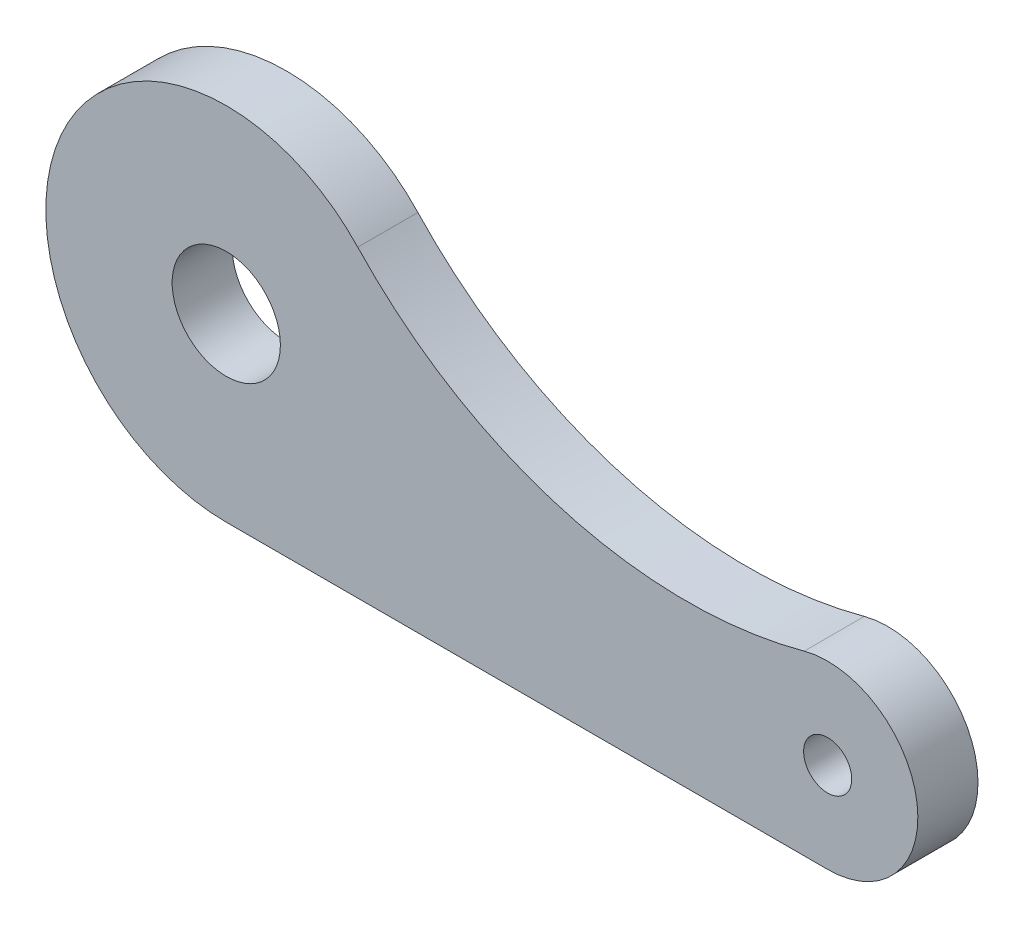
from build123d import *

# Parameters (mm, degrees)
SCHIZZO1_R                   = 4.5
SCHIZZO1_R_2                 = 2
ESTRUSIONE_ESTRUSIONE1_DEPTH = 5


with BuildPart() as part:
    # Schizzo1 → Estrusione-Estrusione1 (new body)
    with BuildSketch(Plane.XY):
        with BuildLine():
            Line((0, -15), (50, -15))
            ThreePointArc((50, -15), (57.434856863, -6.513641332), (48.044417196, -0.259440913))
            ThreePointArc((48.044417196, -0.259440913), (28.031173765, -0.132787617), (10.933286622, 10.269529864))
            ThreePointArc((10.933286622, 10.269529864), (-13.766679846, 5.956385315), (0, -15))
        make_face()
        Circle(SCHIZZO1_R, mode=Mode.SUBTRACT)
        with Locations((50, -7.5)):
            Circle(SCHIZZO1_R_2, mode=Mode.SUBTRACT)
    extrude(amount=ESTRUSIONE_ESTRUSIONE1_DEPTH)


solid = part.part
